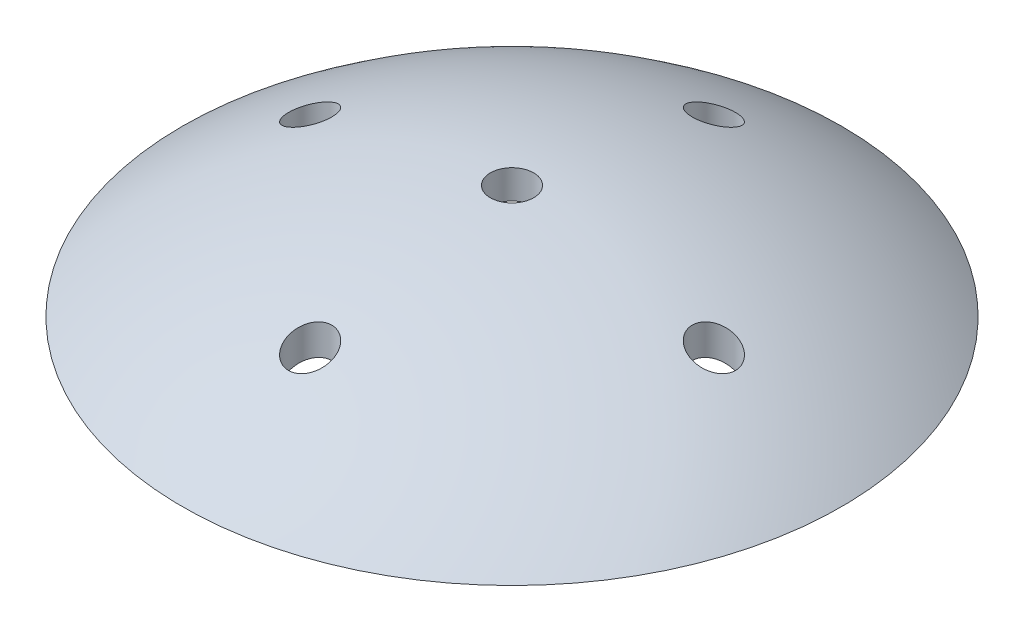
from build123d import *

# Parameters (mm, degrees)
SKETCH3_W          = 96.508277199
SKETCH3_H          = 68.977702825
CUT_EXTRUDE1_DEPTH = 100
SKETCH5_R          = 1.5
CUT_EXTRUDE2_DEPTH = 100
SKETCH6_R          = 1.5
CUT_EXTRUDE3_DEPTH = 100


with BuildPart() as part:
    # Sketch1 → Revolve1 (revolve)
    with BuildSketch(Plane.XY):
        with BuildLine():
            Line((0, 37), (0, 0))
            Line((0, 0), (0, -37))
            ThreePointArc((0, -37), (-37, 0), (0, 37))
        make_face()
    revolve(axis=Axis((0, 51.787709497, 0), (0, -1, 0)))

    # Sketch3 → Cut-Extrude1 (cut, symmetric)
    with BuildSketch(Plane.XY):
        with Locations((2.168158787, -5.395185821)):
            Rectangle(SKETCH3_W, SKETCH3_H)
    extrude(amount=CUT_EXTRUDE1_DEPTH, both=True, mode=Mode.SUBTRACT)

    # Sketch4 → Cut-Revolve1 (revolve, cut)
    with BuildSketch(Plane.XY):
        with BuildLine():
            Line((0, 0), (0, 35))
            ThreePointArc((0, 35), (-35, 0), (0, -35))
            Line((0, -35), (0, 0))
        make_face()
    revolve(axis=Axis((0, 39.939026177, 0), (0, -1, 0)), mode=Mode.SUBTRACT)

    # Sketch5 → Cut-Extrude2 (cut, symmetric)
    with BuildSketch(Plane(origin=(0, 0, 0), x_dir=(1, 0, 0), z_dir=(0, 1, 0))):
        with Locations(Location((0, 14, 0), (0, 0, 122.347198926))):
            Circle(SKETCH5_R)
        with Locations((14, 0)):
            Circle(SKETCH5_R)
        with Locations(Location((0, -14, 0), (0, 0, 148.968284828))):
            Circle(SKETCH5_R)
        with Locations(Location((-14, 0, 0), (0, 0, 359.999999797))):
            Circle(SKETCH5_R)
    extrude(amount=CUT_EXTRUDE2_DEPTH, both=True, mode=Mode.SUBTRACT)

    # Sketch6 → Cut-Extrude3 (cut, symmetric)
    with BuildSketch(Plane(origin=(0, 0, 0), x_dir=(1, 0, 0), z_dir=(0, 1, 0))):
        with Locations(Location((0, 0, 0), (0, 0, 90))):
            Circle(SKETCH6_R)
    extrude(amount=CUT_EXTRUDE3_DEPTH, both=True, mode=Mode.SUBTRACT)


solid = part.part
